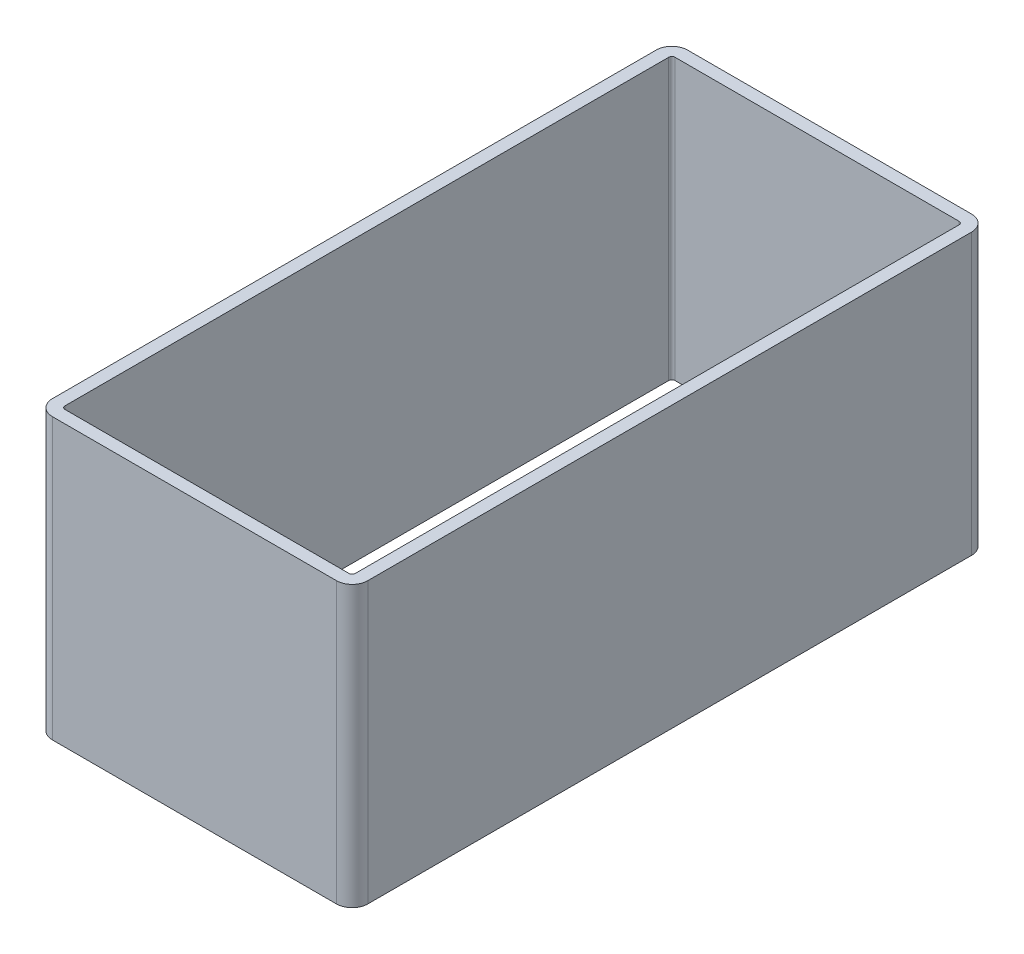
from build123d import *

# Parameters (mm, degrees)
BASES_W            = 20.16
BASES_H            = 40.6
BASE_DEPTH         = 8.95
BASE_F_R           = 1
CUT_EXTRUDE3_DEPTH = 29.880900263


with BuildPart() as part:
    # BaseS → BASE (new, symmetric)
    with BuildSketch(Plane(origin=(0, 0, 0), x_dir=(1, 0, 0), z_dir=(0, 1, 0))):
        Rectangle(BASES_W, BASES_H)
    extrude(amount=BASE_DEPTH, both=True)

    # BASE F
    base_f_edges = [part.edges().sort_by_distance(p)[0] for p in [
        (10.08, 0, 20.3),
        (-10.08, 0, 20.3),
        (-10.08, 0, -20.3),
        (10.08, 0, -20.3),
    ]]
    fillet(base_f_edges, radius=BASE_F_R)

    # PocketS → Cut-Extrude3 (cut, through all)
    with BuildSketch(Plane(origin=(0, 8.95, 0), x_dir=(1, 0, 0), z_dir=(0, 1, 0))):
        with BuildLine():
            Line((9.08, 19.5), (-9.08, 19.5))
            ThreePointArc((-9.08, 19.5), (-9.221421356, 19.441421356), (-9.28, 19.3))
            Line((-9.28, 19.3), (-9.28, -19.3))
            ThreePointArc((-9.28, -19.3), (-9.221421356, -19.441421356), (-9.08, -19.5))
            Line((-9.08, -19.5), (9.08, -19.5))
            ThreePointArc((9.08, -19.5), (9.221421356, -19.441421356), (9.28, -19.3))
            Line((9.28, -19.3), (9.28, 19.3))
            ThreePointArc((9.28, 19.3), (9.221421356, 19.441421356), (9.08, 19.5))
        make_face()
    extrude(amount=-CUT_EXTRUDE3_DEPTH, mode=Mode.SUBTRACT)


solid = part.part
